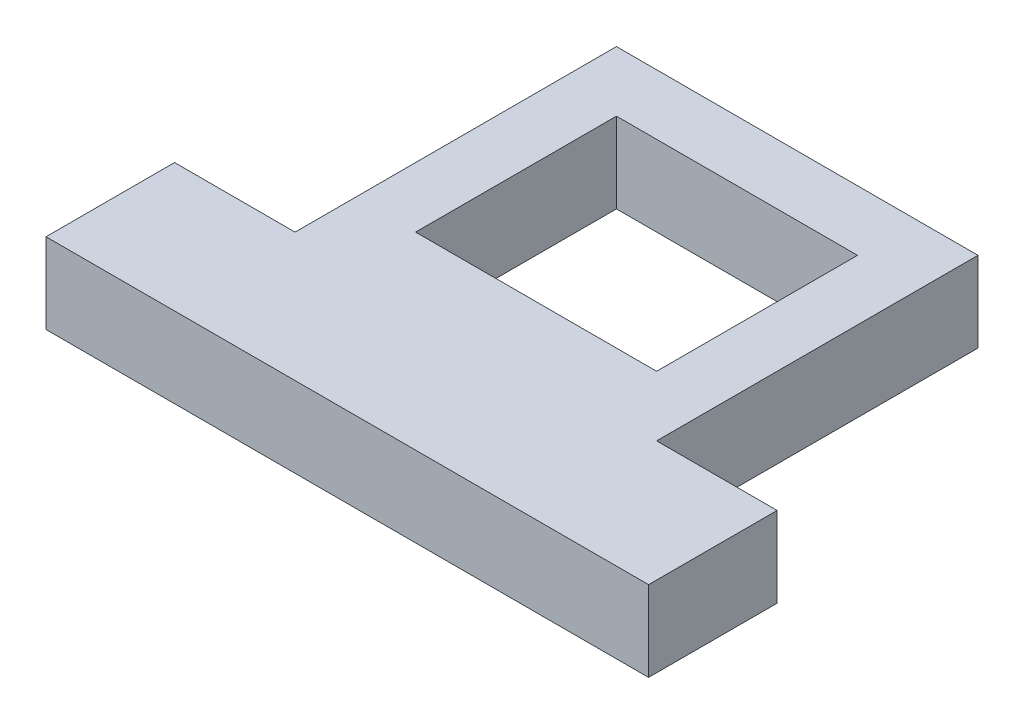
from build123d import *

# Parameters (mm, degrees)
SKETCH1_W           = 9
SKETCH1_H           = 8
SKETCH1_W_2         = 6
SKETCH1_H_2         = 5
BOSS_EXTRUDE1_DEPTH = 2
SKETCH2_W           = 15
SKETCH2_H           = 3.2
BOSS_EXTRUDE3_DEPTH = 2


with BuildPart() as part:
    # Sketch1 → Boss-Extrude1 (new body)
    with BuildSketch(Plane(origin=(0, 0, 0), x_dir=(1, 0, 0), z_dir=(0, 1, 0))):
        Rectangle(SKETCH1_W, SKETCH1_H)
        Rectangle(SKETCH1_W_2, SKETCH1_H_2, mode=Mode.SUBTRACT)
    extrude(amount=BOSS_EXTRUDE1_DEPTH)

    # Sketch2 → Boss-Extrude3 (add)
    with BuildSketch(Plane(origin=(0, 0, 0), x_dir=(1, 0, 0), z_dir=(0, 1, 0))):
        with Locations((0, -5.6)):
            Rectangle(SKETCH2_W, SKETCH2_H)
    extrude(amount=BOSS_EXTRUDE3_DEPTH)


solid = part.part
